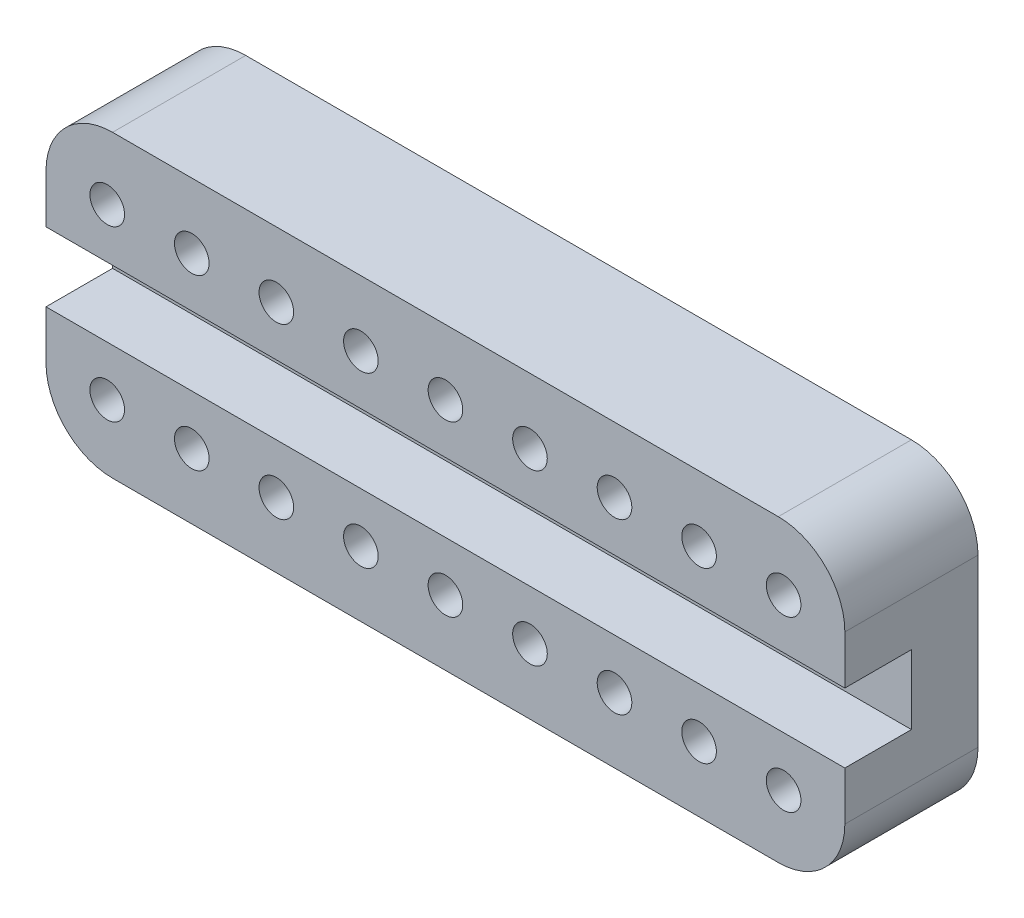
from build123d import *

# Parameters (mm, degrees)
SKETCH_1_W          = 120
SKETCH_1_H          = 45
SKETCH_1_R          = 2.6
EXTRUDE_1_DEPTH     = 20
FILLET_1_R          = 10
CUT_EXTRUDE_1_DEPTH = 10


with BuildPart() as part:
    # 草图1 → 凸台-拉伸1 (new body)
    with BuildSketch(Plane.XY):
        Rectangle(SKETCH_1_W, SKETCH_1_H)
        with Locations((-50.8, 12.7)):
            Circle(SKETCH_1_R, mode=Mode.SUBTRACT)
        with Locations((-50.8, 0)):
            Circle(SKETCH_1_R, mode=Mode.SUBTRACT)
        with Locations((-50.8, -12.7)):
            Circle(SKETCH_1_R, mode=Mode.SUBTRACT)
        with Locations((-38.1, 12.7)):
            Circle(SKETCH_1_R, mode=Mode.SUBTRACT)
        with Locations((-38.1, 0)):
            Circle(SKETCH_1_R, mode=Mode.SUBTRACT)
        with Locations((-38.1, -12.7)):
            Circle(SKETCH_1_R, mode=Mode.SUBTRACT)
        with Locations((-25.4, 12.7)):
            Circle(SKETCH_1_R, mode=Mode.SUBTRACT)
        with Locations((-25.4, 0)):
            Circle(SKETCH_1_R, mode=Mode.SUBTRACT)
        with Locations((-25.4, -12.7)):
            Circle(SKETCH_1_R, mode=Mode.SUBTRACT)
        with Locations((-12.7, 12.7)):
            Circle(SKETCH_1_R, mode=Mode.SUBTRACT)
        with Locations((-12.7, 0)):
            Circle(SKETCH_1_R, mode=Mode.SUBTRACT)
        with Locations((-12.7, -12.7)):
            Circle(SKETCH_1_R, mode=Mode.SUBTRACT)
        with Locations((0, 12.7)):
            Circle(SKETCH_1_R, mode=Mode.SUBTRACT)
        Circle(SKETCH_1_R, mode=Mode.SUBTRACT)
        with Locations((0, -12.7)):
            Circle(SKETCH_1_R, mode=Mode.SUBTRACT)
        with Locations((12.7, 12.7)):
            Circle(SKETCH_1_R, mode=Mode.SUBTRACT)
        with Locations((12.7, 0)):
            Circle(SKETCH_1_R, mode=Mode.SUBTRACT)
        with Locations((12.7, -12.7)):
            Circle(SKETCH_1_R, mode=Mode.SUBTRACT)
        with Locations((25.4, 12.7)):
            Circle(SKETCH_1_R, mode=Mode.SUBTRACT)
        with Locations((25.4, 0)):
            Circle(SKETCH_1_R, mode=Mode.SUBTRACT)
        with Locations((25.4, -12.7)):
            Circle(SKETCH_1_R, mode=Mode.SUBTRACT)
        with Locations((38.1, 12.7)):
            Circle(SKETCH_1_R, mode=Mode.SUBTRACT)
        with Locations((38.1, 0)):
            Circle(SKETCH_1_R, mode=Mode.SUBTRACT)
        with Locations((38.1, -12.7)):
            Circle(SKETCH_1_R, mode=Mode.SUBTRACT)
        with Locations((50.8, 12.7)):
            Circle(SKETCH_1_R, mode=Mode.SUBTRACT)
        with Locations((50.8, 0)):
            Circle(SKETCH_1_R, mode=Mode.SUBTRACT)
        with Locations((50.8, -12.7)):
            Circle(SKETCH_1_R, mode=Mode.SUBTRACT)
    extrude(amount=EXTRUDE_1_DEPTH)

    # 圆角1
    fillet_1_edges = [part.edges().sort_by_distance(p)[0] for p in [
        (60, -22.5, 10),
        (-60, -22.5, 10),
        (-60, 22.5, 10),
        (60, 22.5, 10),
    ]]
    fillet(fillet_1_edges, radius=FILLET_1_R)

    # 草图2 → 切除-拉伸1 (cut)
    with BuildSketch(Plane.XY.offset(20)):
        with BuildLine():
            Line((-60, 5.2), (65.881182767, 5.2))
            ThreePointArc((65.881182767, 5.2), (71.081182767, 0), (65.881182767, -5.2))
            Line((65.881182767, -5.2), (-60, -5.2))
            ThreePointArc((-60, -5.2), (-65.2, 0), (-60, 5.2))
        make_face()
    extrude(amount=-CUT_EXTRUDE_1_DEPTH, mode=Mode.SUBTRACT)


solid = part.part
